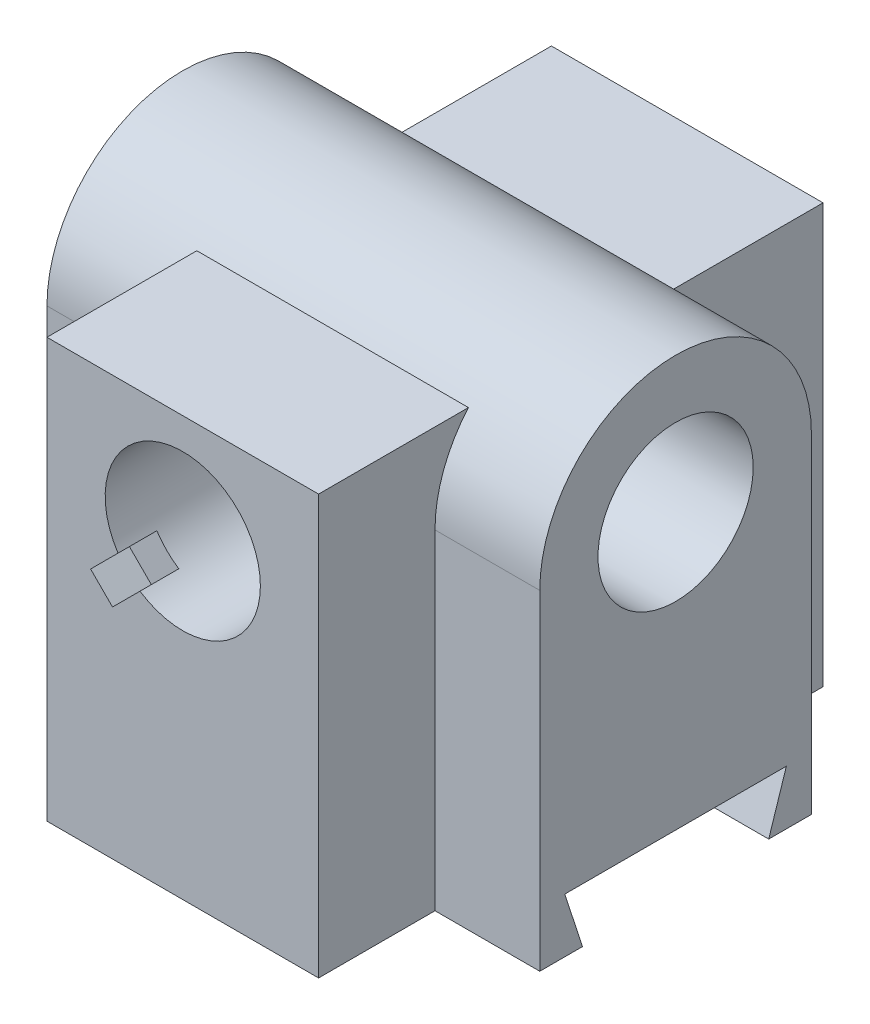
from build123d import *

# Parameters (mm, degrees)
BOSS_EXTRUDE1_DEPTH      = 31
BOSS_EXTRUDE1_DEPTH_BACK = 32.5
SKETCH1_W                = 35
SKETCH1_H                = 60
FILLET2_RADIUS           = 17.5
FILLET2_LENGTH           = 63.5
BOSS_EXTRUDE2_DEPTH      = 32.5
BOSS_EXTRUDE2_DEPTH_BACK = 32.5
SKETCH8_W                = 35
SKETCH8_H                = 54
HOLE2_D                  = 20
CUT_EXTRUDE1_START       = -5
CUT_EXTRUDE1_DEPTH       = 5
CUT_EXTRUDE2_DEPTH       = 78.38539914
HOLE3_D                  = 20


with BuildPart() as part:
    # Sketch1 → Boss-Extrude1 (new, two sides: drawn at the far end of the back side and taken through both)
    with BuildSketch(Plane(origin=(0, 0, 0), x_dir=(0, 0, -1), z_dir=(1, 0, 0)).offset(-BOSS_EXTRUDE1_DEPTH_BACK)):
        Rectangle(SKETCH1_W, SKETCH1_H)
    extrude(amount=BOSS_EXTRUDE1_DEPTH + BOSS_EXTRUDE1_DEPTH_BACK)

    # Fillet2: full round fillet: the end face becomes a half cylinder, R = half its width
    fillet2_face = Plane((-0.75, 30, 0), x_dir=(1, 0, 0), z_dir=(0, 1, 0))  # on the end face: x along it, z out of the body
    fillet2_slab = fillet2_face.offset(-FILLET2_RADIUS / 2) * Box(FILLET2_LENGTH, 2 * FILLET2_RADIUS, FILLET2_RADIUS, mode=Mode.PRIVATE)  # the body's end, R deep
    fillet2_round = Plane((-0.75, 12.5, 0), x_dir=(0, 1, 0), z_dir=(1, 0, 0)) * Cylinder(FILLET2_RADIUS, FILLET2_LENGTH, mode=Mode.PRIVATE)  # its axis R under the face
    add(fillet2_slab - fillet2_round, mode=Mode.SUBTRACT)

    # Sketch8 → Boss-Extrude2 (add, two sides: drawn at the far end of the back side and taken through both)
    with BuildSketch(Plane.XY.offset(-BOSS_EXTRUDE2_DEPTH_BACK)):
        with Locations((0, -3)):
            Rectangle(SKETCH8_W, SKETCH8_H)
    extrude(amount=BOSS_EXTRUDE2_DEPTH + BOSS_EXTRUDE2_DEPTH_BACK)

    # Hole2 (through all)
    with Locations(Plane.XY.offset(32.5)):
        with Locations((0, 10)):
            Hole(HOLE2_D / 2)

    # Sketch14 → Cut-Extrude1 (cut)
    with BuildSketch(Plane.XY.offset(32.5).offset(CUT_EXTRUDE1_START)):
        with BuildLine():
            Line((-8.342416793, 4.486010332), (-11.877950699, 0.950476426))
            Line((-11.877950699, 0.950476426), (-9.049523574, -1.877950699))
            Line((-9.049523574, -1.877950699), (-5.513989668, 1.657583207))
            ThreePointArc((-5.513989668, 1.657583207), (-7.071067812, 2.928932188), (-8.342416793, 4.486010332))
        make_face()
    extrude(amount=CUT_EXTRUDE1_DEPTH, mode=Mode.SUBTRACT)

    # Sketch15 → Cut-Extrude2 (cut, through all)
    with BuildSketch(Plane(origin=(31, 0, 0), x_dir=(0, 0, -1), z_dir=(1, 0, 0))):
        Polygon((-12, -30), (-14.274437874, -23), (14.274437874, -23), (12, -30), align=None)
    extrude(amount=-CUT_EXTRUDE2_DEPTH, mode=Mode.SUBTRACT)

    # Hole3 (through all)
    with Locations(Plane(origin=(31, 0, 0), x_dir=(0, 0, -1), z_dir=(1, 0, 0))):
        with Locations((0, 12.5)):
            Hole(HOLE3_D / 2)


solid = part.part
